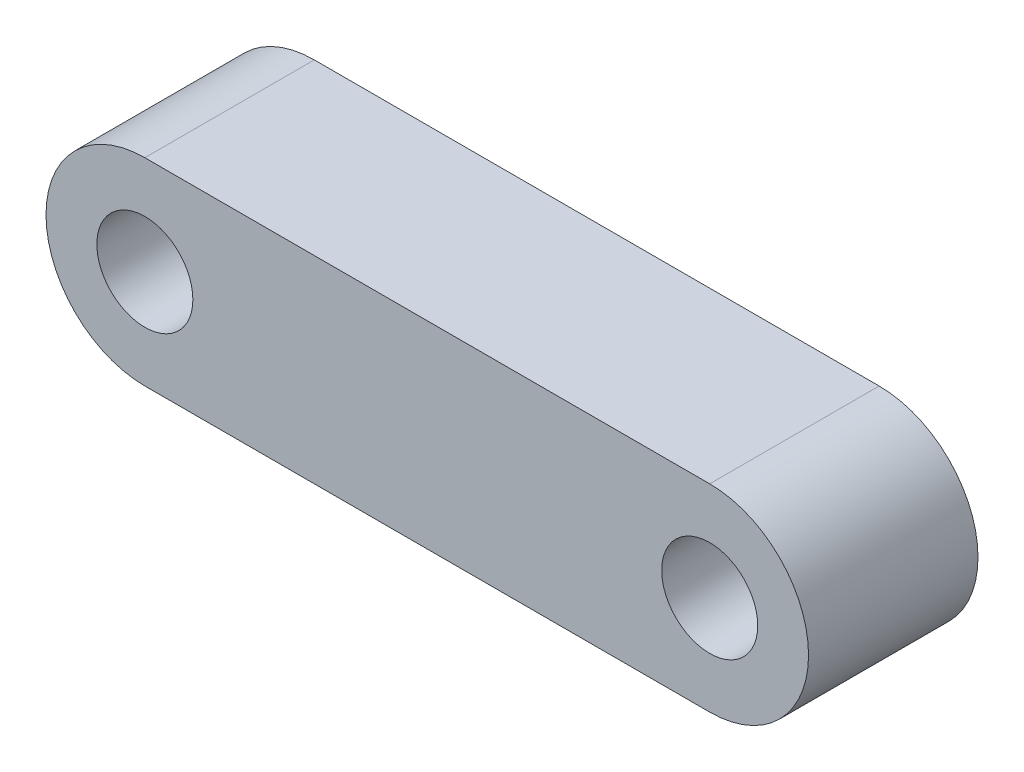
from build123d import *

# Parameters (mm, degrees)
ESBO_O1_R                = 1.7
RESSALTO_EXTRUS_O1_DEPTH = 6
CORTE_EXTRUS_O1_DEPTH    = 7.5


with BuildPart() as part:
    # Esboço1 → Ressalto-extrusão1 (new body)
    with BuildSketch(Plane.XY):
        with BuildLine():
            Line((10, 3.5), (-10, 3.5))
            ThreePointArc((-10, 3.5), (-13.5, 0), (-10, -3.5))
            Line((-10, -3.5), (10, -3.5))
            ThreePointArc((10, -3.5), (13.5, 0), (10, 3.5))
        make_face()
        with Locations((-10, 0)):
            Circle(ESBO_O1_R, mode=Mode.SUBTRACT)
        with Locations((10, 0)):
            Circle(ESBO_O1_R, mode=Mode.SUBTRACT)
    extrude(amount=RESSALTO_EXTRUS_O1_DEPTH)

    # Esboço2 → Corte-extrusão1 (cut, symmetric)
    with BuildSketch(Plane(origin=(0, 0, 0), x_dir=(0, 0, -1), z_dir=(1, 0, 0))):
        Polygon((0, 3.5), (-0.7, 3.1), (-0.7, 2.9), (0, 2.5), align=None)
        Polygon((0, 1.5), (-0.7, 1.1), (-0.7, 0.9), (0, 0.5), align=None)
        Polygon((0, -0.5), (-0.7, -0.9), (-0.7, -1.1), (0, -1.5), align=None)
        Polygon((0, -2.5), (-0.7, -2.9), (-0.7, -3.1), (0, -3.5), align=None)
    extrude(amount=CORTE_EXTRUS_O1_DEPTH, both=True, mode=Mode.SUBTRACT)


solid = part.part
